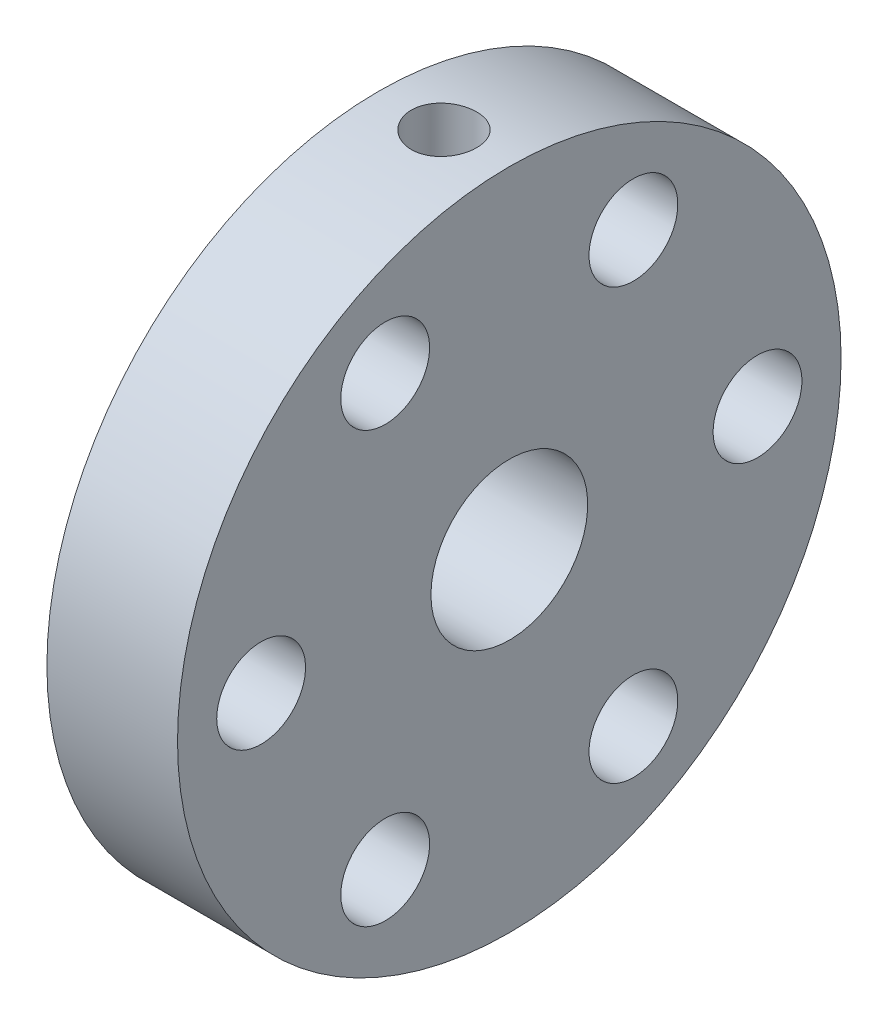
from build123d import *

# Parameters (mm, degrees)
ESQUISSE1_W                                  = 4.2
ESQUISSE1_H                                  = 3
ESQUISSE1_W_2                                = 5
ESQUISSE1_H_2                                = 9.7
D_GAGEMENT_M31_D                             = 3.4
ESQUISSE4_W                                  = 1.25
ESQUISSE4_H                                  = 12.7
TROU_POUR_TARAUDAGE_POUR_TROU_TARAUD_2_COUNT = 2
TROU_POUR_TARAUDAGE_POUR_TROU_TARAUD_2_PITCH = 4.6


with BuildPart() as part:
    # Esquisse1 → Révolution1 (revolve)
    with BuildSketch(Plane.XY, mode=Mode.PRIVATE) as r_volution1_sk:
        with Locations((-2.1, 4.5)):
            Rectangle(ESQUISSE1_W, ESQUISSE1_H)
        with Locations((2.5, 7.85)):
            Rectangle(ESQUISSE1_W_2, ESQUISSE1_H_2)
    revolve(r_volution1_sk.sketch.rotate(Axis((0, 0, 0), (1, 0, 0)), 90), axis=Axis((0, 0, 0), (1, 0, 0)))

    # Dégagement M31 (through all)
    with Locations(Plane.ZY):
        with Locations((4.75, 8.227241336), (-4.75, 8.227241336), (-9.5, 0), (-4.75, -8.227241336), (4.75, -8.227241336), (9.5, 0)):
            Hole(D_GAGEMENT_M31_D / 2)

    # Esquisse4 → Trou pour taraudage pour trou taraudé M3x0.51 (revolve, cut)
    with BuildSketch(Plane(origin=(2.5, 0, 0), x_dir=(0, 0, -1), z_dir=(1, 0, 0))):
        with Locations((0.625, 6.35)):
            Rectangle(ESQUISSE4_W, ESQUISSE4_H)
    trou_pour_taraudage_pour_trou_taraud_m3 = revolve(axis=Axis((2.5, -6.35, 0), (0, 1, 0)), mode=Mode.SUBTRACT)

    # Trou pour taraudage pour trou taraud 2: Trou pour taraudage pour trou taraudé M3x0.51 ×2
    with Locations(*[(-i * TROU_POUR_TARAUDAGE_POUR_TROU_TARAUD_2_PITCH, 0, 0) for i in range(1, TROU_POUR_TARAUDAGE_POUR_TROU_TARAUD_2_COUNT)]):
        add(trou_pour_taraudage_pour_trou_taraud_m3, mode=Mode.SUBTRACT)


solid = part.part
